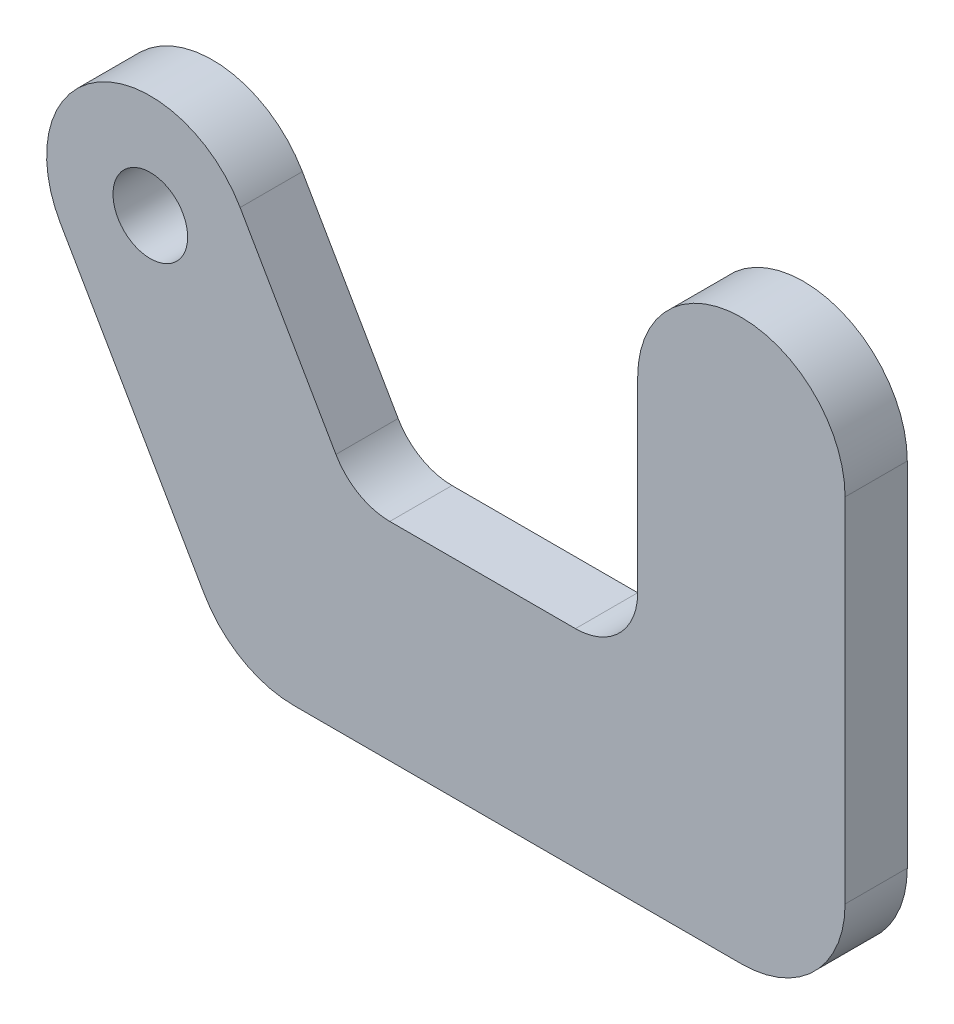
from build123d import *

# Parameters (mm, degrees)
SKETCH1_R           = 1.8
BOSS_EXTRUDE1_DEPTH = 3
FILLET2_R           = 5
FILLET3_R           = 3


with BuildPart() as part:
    # Sketch1 → Boss-Extrude1 (new body)
    with BuildSketch(Plane.XY):
        with BuildLine():
            Line((4.330127019, 2.5), (9.814954576, -7))
            Line((9.814954576, -7), (23.5, -7))
            Line((23.5, -7), (23.5, 5))
            ThreePointArc((23.5, 5), (28.5, 10), (33.5, 5))
            Line((33.5, 5), (33.5, -17))
            Line((33.5, -17), (4.041451884, -17))
            Line((4.041451884, -17), (-4.330127019, -2.5))
            ThreePointArc((-4.330127019, -2.5), (-2.5, 4.330127019), (4.330127019, 2.5))
        make_face()
        Circle(SKETCH1_R, mode=Mode.SUBTRACT)
    extrude(amount=BOSS_EXTRUDE1_DEPTH)

    # Fillet2
    fillet2_edges = [part.edges().sort_by_distance(p)[0] for p in [
        (33.5, -17, 1.5),
        (4.041451884, -17, 1.5),
    ]]
    fillet(fillet2_edges, radius=FILLET2_R)

    # Fillet3
    fillet3_edges = [part.edges().sort_by_distance(p)[0] for p in [
        (9.814954576, -7, 1.5),
        (23.5, -7, 1.5),
    ]]
    fillet(fillet3_edges, radius=FILLET3_R)


solid = part.part
